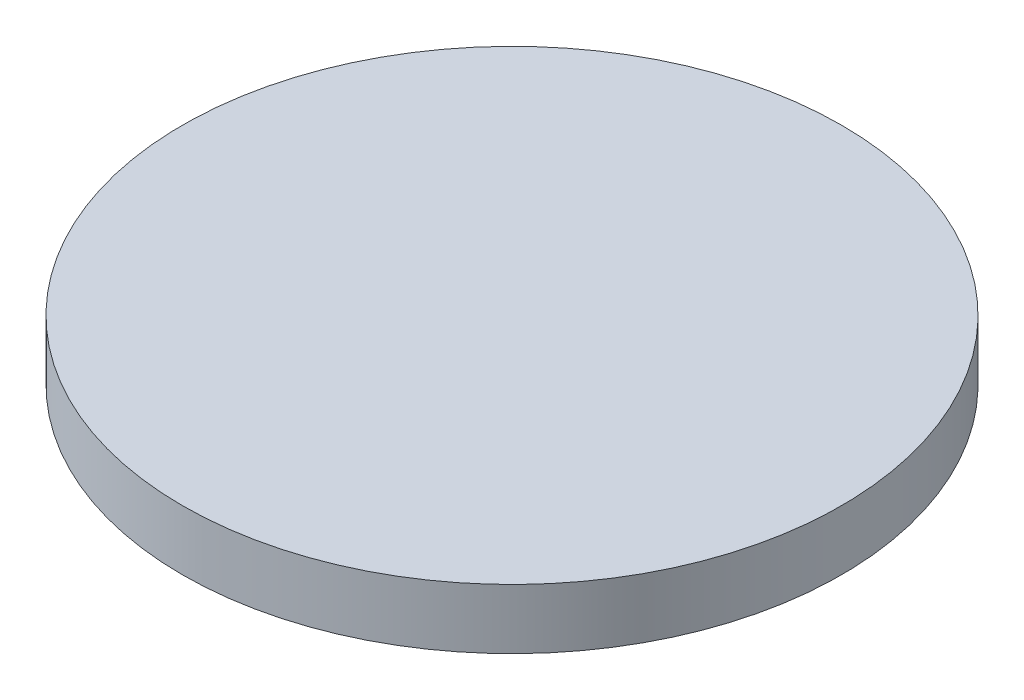
from build123d import *

# Parameters (mm, degrees)
BASES_R    = 2.75
BASE_DEPTH = 0.5


with BuildPart() as part:
    # BaseS → BASE (new body)
    with BuildSketch(Plane(origin=(0, 0, 0), x_dir=(1, 0, 0), z_dir=(0, 1, 0))):
        with Locations(Location((0, 0, 0), (0, 0, 270))):
            Circle(BASES_R)
    extrude(amount=-BASE_DEPTH)


solid = part.part
